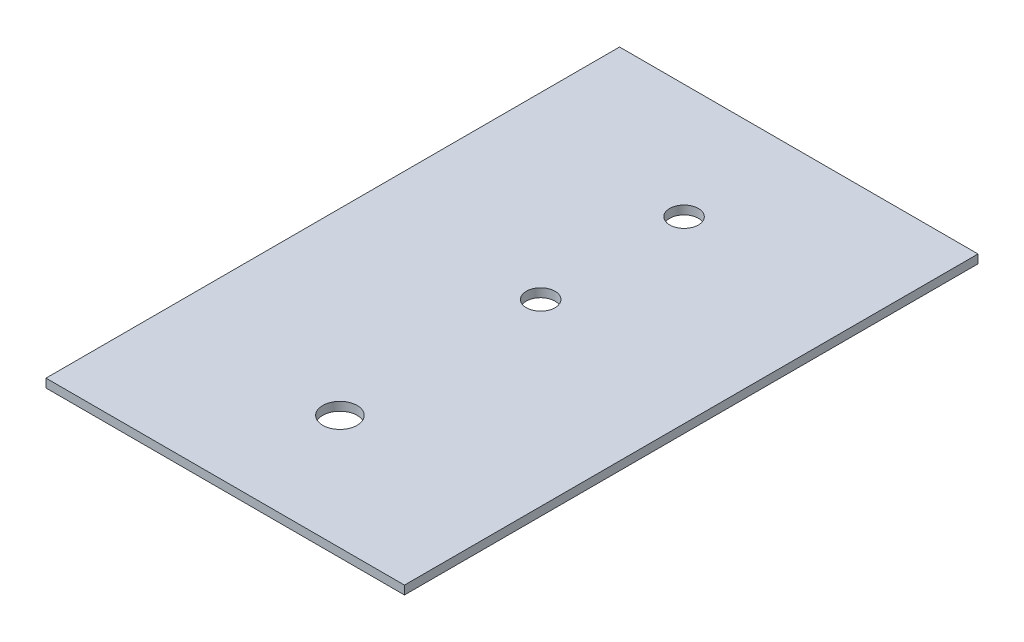
from build123d import *

# Parameters (mm, degrees)
SKETCH1_W           = 125
SKETCH1_H           = 200
BOSS_EXTRUDE1_DEPTH = 3
SKETCH2_R           = 5
SKETCH2_R_2         = 6
CUT_EXTRUDE1_DEPTH  = 3


with BuildPart() as part:
    # Sketch1 → Boss-Extrude1 (new body)
    with BuildSketch(Plane(origin=(0, 0, 0), x_dir=(1, 0, 0), z_dir=(0, 1, 0))):
        Rectangle(SKETCH1_W, SKETCH1_H)
    extrude(amount=BOSS_EXTRUDE1_DEPTH)

    # Sketch2 → Cut-Extrude1 (cut)
    with BuildSketch(Plane(origin=(0, 3, 0), x_dir=(1, 0, 0), z_dir=(0, 1, 0))):
        with Locations(Location((0, 60, 0), (0, 0, 270))):
            Circle(SKETCH2_R)
        with Locations(Location((0, -60, 0), (0, 0, 270))):
            Circle(SKETCH2_R_2)
        with Locations(Location((0, 10, 0), (0, 0, 270))):
            Circle(SKETCH2_R)
    extrude(amount=-CUT_EXTRUDE1_DEPTH, mode=Mode.SUBTRACT)


solid = part.part
